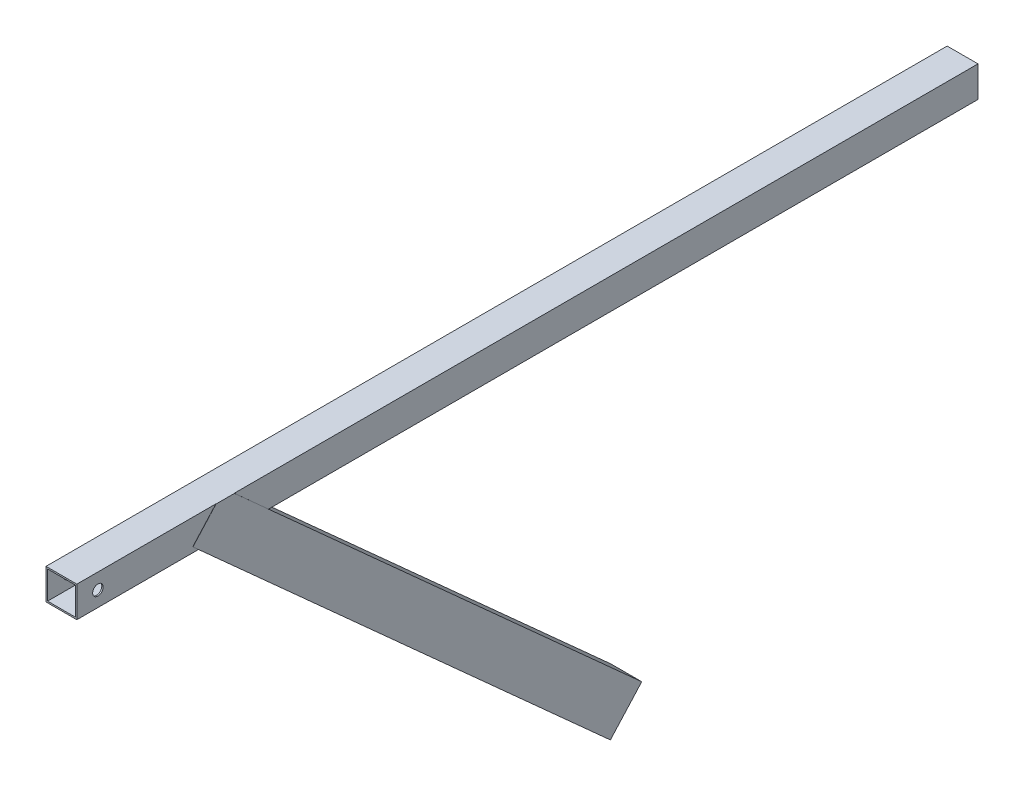
from build123d import *

# Parameters (mm, degrees)
SKETCH2_W           = 26.352182783
SKETCH2_H           = 26.352182783
SKETCH2_W_2         = 23.8
SKETCH2_H_2         = 23.8
BOSS_EXTRUDE1_DEPTH = 385
SKETCH3_R           = 4.5
CUT_EXTRUDE1_DEPTH  = 387.799528276
SKETCH4_W           = 26.521697909
SKETCH4_H           = 40
SKETCH4_W_2         = 19.891273431
SKETCH4_H_2         = 30
BOSS_EXTRUDE2_DEPTH = 480
CUT_EXTRUDE2_DEPTH  = 500.249823585


with BuildPart() as part:
    # Sketch2 → Boss-Extrude1 (new, symmetric)
    with BuildSketch(Plane.XY):
        with Locations((-13.176091391, 13.176091391)):
            Rectangle(SKETCH2_W, SKETCH2_H)
        with Locations((-13.091333829, 13.176091663)):
            Rectangle(SKETCH2_W_2, SKETCH2_H_2, mode=Mode.SUBTRACT)
    extrude(amount=BOSS_EXTRUDE1_DEPTH, both=True)

    # Sketch3 → Cut-Extrude1 (cut, through all)
    with BuildSketch(Plane.ZY.offset(26.352182783)):
        with Locations((367, 13)):
            Circle(SKETCH3_R)
    extrude(amount=-CUT_EXTRUDE1_DEPTH, mode=Mode.SUBTRACT)

    # Sketch4 → Boss-Extrude2 (add)
    with BuildSketch(Plane(origin=(0, -176.990909821, -196.568319459), x_dir=(1, 0, 0), z_dir=(0, 0.6691306063588407, 0.7431448254774101))):
        with Locations((-13.091333828, -168.046187829)):
            Rectangle(SKETCH4_W, SKETCH4_H)
        with Locations((-13.091333829, -168.046187829)):
            Rectangle(SKETCH4_W_2, SKETCH4_H_2, mode=Mode.SUBTRACT)
    extrude(amount=BOSS_EXTRUDE2_DEPTH)

    # Sketch5 → Cut-Extrude2 (cut, through all)
    with BuildSketch(Plane.ZY.offset(26.352182783)):
        Polygon((266.244447792, 26.352182783), (250.51862, 26.352182783), (259.203432202, 34.172022814), align=None)
    extrude(amount=-CUT_EXTRUDE2_DEPTH, mode=Mode.SUBTRACT)


solid = part.part
